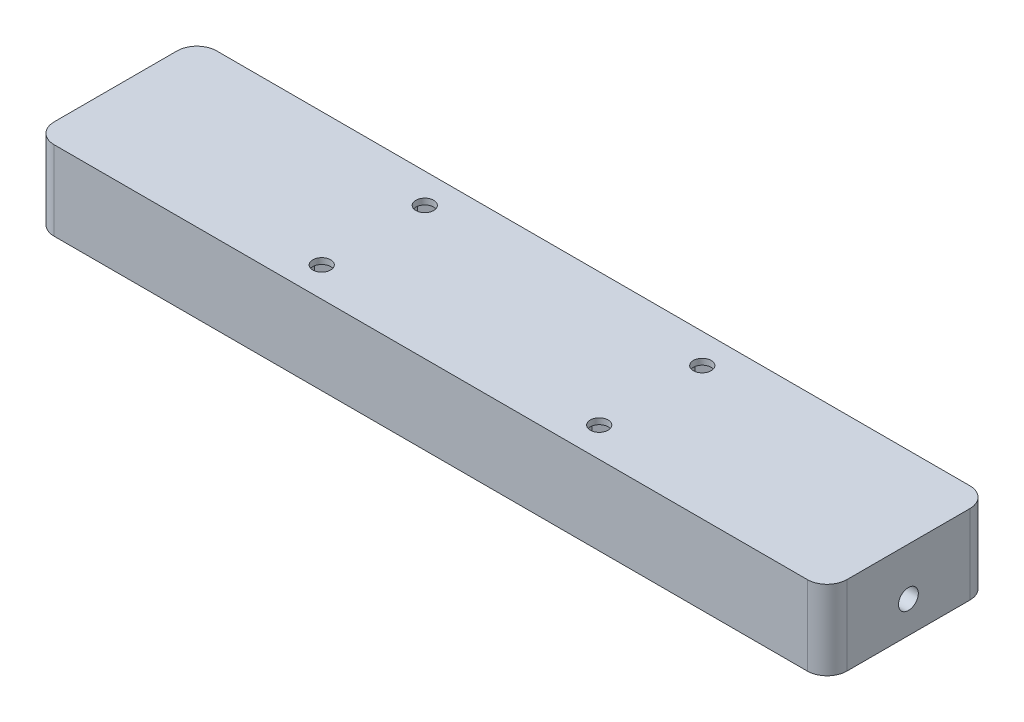
from build123d import *

# Parameters (mm, degrees)
SKETCH1_W                = 200
SKETCH1_H                = 41
BOSS_EXTRUDE1_DEPTH      = 20
FILLET1_R                = 5
SKETCH4_R                = 2.5
CUT_EXTRUDE1_DEPTH       = 206.136539895
SKETCH5_W                = 190
SKETCH5_H                = 31
CUT_EXTRUDE2_DEPTH       = 15
M4_CLEARANCE_HOLE1_D     = 4.5
M4_CLEARANCE_HOLE1_DEPTH = 8
M4_CLEARANCE_HOLE1_TIP   = 1.351936393
CUT_EXTRUDE3_START       = -3.5
CUT_EXTRUDE3_DEPTH       = 7.5
LPATTERN1_COUNT          = 2
LPATTERN1_PITCH          = 70
LPATTERN1_COUNT_DIR2     = 2
LPATTERN1_PITCH_DIR2     = 26


with BuildPart() as part:
    # Sketch1 → Boss-Extrude1 (new body)
    with BuildSketch(Plane(origin=(0, 0, 0), x_dir=(1, 0, 0), z_dir=(0, 1, 0))):
        with Locations((100, 20.5)):
            Rectangle(SKETCH1_W, SKETCH1_H)
    extrude(amount=BOSS_EXTRUDE1_DEPTH)

    # Fillet1
    fillet1_edges = [part.edges().sort_by_distance(p)[0] for p in [
        (0, 10, -41),
        (200, 10, -41),
        (200, 10, 0),
        (0, 10, 0),
    ]]
    fillet(fillet1_edges, radius=FILLET1_R)

    # Sketch4 → Cut-Extrude1 (cut, through all)
    with BuildSketch(Plane.ZY):
        with Locations((-20.5, 8)):
            Circle(SKETCH4_R)
    extrude(amount=-CUT_EXTRUDE1_DEPTH, mode=Mode.SUBTRACT)

    # Sketch5 → Cut-Extrude2 (cut)
    with BuildSketch(Plane.XZ):
        with Locations((100, -20.5)):
            Rectangle(SKETCH5_W, SKETCH5_H)
    extrude(amount=-CUT_EXTRUDE2_DEPTH, mode=Mode.SUBTRACT)

    # M4 Clearance Hole1
    with Locations(Plane(origin=(135, 20, -7.5), x_dir=(0, 0, 1), z_dir=(0, 1, 0))):
        with Locations((0, 0), (-26, -70), (-26, 0), (0, -70)):
            Hole(M4_CLEARANCE_HOLE1_D / 2, depth=M4_CLEARANCE_HOLE1_DEPTH)
            with Locations((0, 0, -(M4_CLEARANCE_HOLE1_DEPTH + M4_CLEARANCE_HOLE1_TIP / 2))):  # 118° drill point
                Cone(0, M4_CLEARANCE_HOLE1_D / 2, M4_CLEARANCE_HOLE1_TIP, mode=Mode.SUBTRACT)

    # Sketch7 → Cut-Extrude3 (cut)
    with BuildSketch(Plane.XZ.offset(-15).offset(CUT_EXTRUDE3_START)):
        Polygon((65, -12.407477288), (69.25, -9.953738644), (69.25, -5.046261356), (65, -2.592522712), (60.75, -5.046261356), (60.75, -9.953738644), align=None)
    cut_extrude3 = extrude(amount=CUT_EXTRUDE3_DEPTH, mode=Mode.SUBTRACT)

    # LPattern1: Cut-Extrude3 2 × 2
    with Locations(*[(i * LPATTERN1_PITCH, 0, -j * LPATTERN1_PITCH_DIR2) for i in range(LPATTERN1_COUNT) for j in range(LPATTERN1_COUNT_DIR2) if (i, j) != (0, 0)]):
        add(cut_extrude3, mode=Mode.SUBTRACT)


solid = part.part
